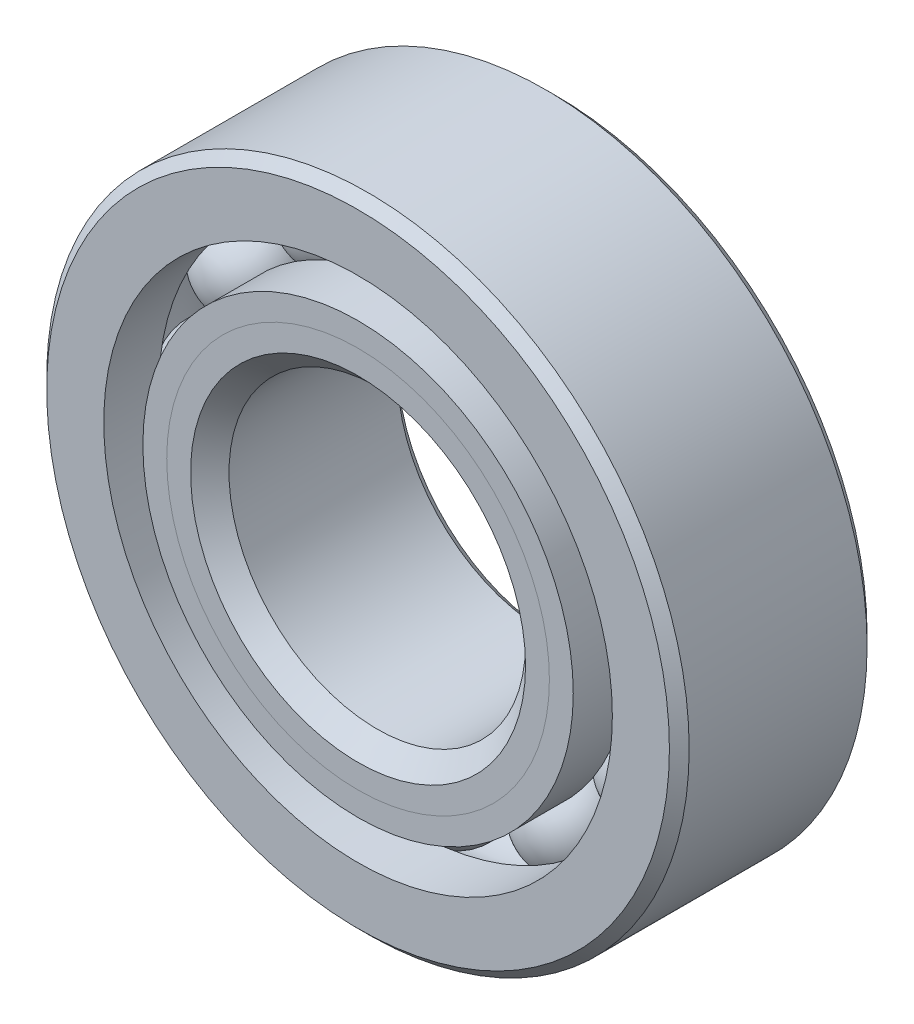
from build123d import *

# Parameters (mm, degrees)
CIRPATTERN1_COUNT = 12


with BuildPart() as part:
    # Sketch1 → Revolve1 (revolve)
    with BuildSketch(Plane(origin=(0, 0, 0), x_dir=(0, 0, -1), z_dir=(1, 0, 0))):
        with BuildLine():
            Line((5.715, 20.6375), (-5.715, 20.6375))
            Line((-5.715, 20.6375), (-6.35, 20.0025))
            Line((-6.35, 20.0025), (-6.35, 16.337293956))
            Line((-6.35, 16.337293956), (-2.822222222, 16.337293956))
            ThreePointArc((-2.822222222, 16.337293956), (0, 18.170357426), (2.822222222, 16.337293956))
            Line((2.822222222, 16.337293956), (6.35, 16.337293956))
            Line((6.35, 16.337293956), (6.35, 20.0025))
            Line((6.35, 20.0025), (5.715, 20.6375))
        make_face()
    revolve(axis=Axis((0, 0, 6.35), (0, 0, -1)))


with BuildPart() as body_2:
    # Sketch2 → Revolve2 (revolve)
    with BuildSketch(Plane(origin=(0, 0, 0), x_dir=(0, 0, -1), z_dir=(1, 0, 0))):
        with BuildLine():
            Line((-6.35, 13.825206044), (-2.822222222, 13.825206044))
            ThreePointArc((-2.822222222, 13.825206044), (-1.682636321, 12.490628511), (0, 11.992142574))
            Line((0, 11.992142574), (0, 10.758571287))
            Line((0, 10.758571287), (-4.816682621, 10.758571287))
            Line((-4.816682621, 10.758571287), (-6.35, 12.291888665))
            Line((-6.35, 12.291888665), (-6.35, 13.825206044))
        make_face()
    revolve(axis=Axis((0, 0, 6.35), (0, 0, -1)))


with BuildPart() as body_3:
    # Sketch3 → Revolve3 (revolve)
    with BuildSketch(Plane(origin=(0, 0, 0), x_dir=(0, 0, -1), z_dir=(1, 0, 0))):
        with BuildLine():
            Line((-6.35, 12.291888665), (-4.816682621, 10.758571287))
            Line((-4.816682621, 10.758571287), (0, 10.758571287))
            Line((0, 10.758571287), (0, 11.992142574))
            ThreePointArc((0, 11.992142574), (1.682636321, 12.490628511), (2.822222222, 13.825206044))
            Line((2.822222222, 13.825206044), (6.35, 13.825206044))
            Line((6.35, 13.825206044), (6.35, 10.16))
            Line((6.35, 10.16), (5.715, 9.525))
            Line((5.715, 9.525), (-5.116428713, 9.525))
            Line((-5.116428713, 9.525), (-6.35, 10.758571287))
            Line((-6.35, 10.758571287), (-6.35, 12.291888665))
        make_face()
    revolve(axis=Axis((0, 0, 6.35), (0, 0, -1)))


with BuildPart() as body_4:
    # Sketch4 → Revolve4 (revolve)
    with BuildSketch(Plane(origin=(0, 0, 0), x_dir=(0, 0, -1), z_dir=(1, 0, 0))):
        with BuildLine():
            Line((-3.089107426, 15.08125), (3.089107426, 15.08125))
            ThreePointArc((3.089107426, 15.08125), (0, 18.170357426), (-3.089107426, 15.08125))
        make_face()
    revolve(axis=Axis((0, 15.08125, 3.089107426), (0, 0, -1)))


with BuildPart() as cirpattern1_1:
    # CirPattern1: pattern copy
    add(body_4.part.rotate(Axis((0, 0, -6.35), (0, 0, 1)), 1 * 360 / CIRPATTERN1_COUNT))


with BuildPart() as cirpattern1_2:
    # CirPattern1: pattern copy
    add(body_4.part.rotate(Axis((0, 0, -6.35), (0, 0, 1)), 2 * 360 / CIRPATTERN1_COUNT))


with BuildPart() as cirpattern1_3:
    # CirPattern1: pattern copy
    add(body_4.part.rotate(Axis((0, 0, -6.35), (0, 0, 1)), 3 * 360 / CIRPATTERN1_COUNT))


with BuildPart() as cirpattern1_4:
    # CirPattern1: pattern copy
    add(body_4.part.rotate(Axis((0, 0, -6.35), (0, 0, 1)), 4 * 360 / CIRPATTERN1_COUNT))


with BuildPart() as cirpattern1_5:
    # CirPattern1: pattern copy
    add(body_4.part.rotate(Axis((0, 0, -6.35), (0, 0, 1)), 5 * 360 / CIRPATTERN1_COUNT))


with BuildPart() as cirpattern1_6:
    # CirPattern1: pattern copy
    add(body_4.part.rotate(Axis((0, 0, -6.35), (0, 0, 1)), 6 * 360 / CIRPATTERN1_COUNT))


with BuildPart() as cirpattern1_7:
    # CirPattern1: pattern copy
    add(body_4.part.rotate(Axis((0, 0, -6.35), (0, 0, 1)), 7 * 360 / CIRPATTERN1_COUNT))


with BuildPart() as cirpattern1_8:
    # CirPattern1: pattern copy
    add(body_4.part.rotate(Axis((0, 0, -6.35), (0, 0, 1)), 8 * 360 / CIRPATTERN1_COUNT))


with BuildPart() as cirpattern1_9:
    # CirPattern1: pattern copy
    add(body_4.part.rotate(Axis((0, 0, -6.35), (0, 0, 1)), 9 * 360 / CIRPATTERN1_COUNT))


with BuildPart() as cirpattern1_10:
    # CirPattern1: pattern copy
    add(body_4.part.rotate(Axis((0, 0, -6.35), (0, 0, 1)), 10 * 360 / CIRPATTERN1_COUNT))


with BuildPart() as cirpattern1_11:
    # CirPattern1: pattern copy
    add(body_4.part.rotate(Axis((0, 0, -6.35), (0, 0, 1)), 11 * 360 / CIRPATTERN1_COUNT))


solid = Compound([part.part, body_2.part, body_3.part, body_4.part, cirpattern1_1.part, cirpattern1_2.part, cirpattern1_3.part, cirpattern1_4.part, cirpattern1_5.part, cirpattern1_6.part, cirpattern1_7.part, cirpattern1_8.part, cirpattern1_9.part, cirpattern1_10.part, cirpattern1_11.part])
